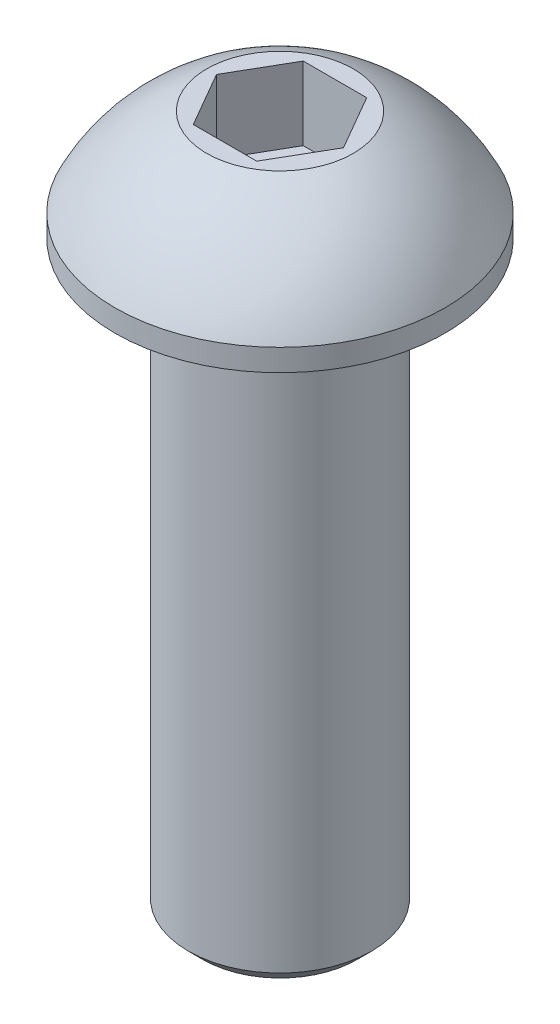
from build123d import *

# Parameters (mm, degrees)
CHAMFER1_SIZE      = 0.2
CUT_EXTRUDE1_START = 0.5
CUT_EXTRUDE1_DEPTH = 10
FILLET1_R          = 0.2


with BuildPart() as part:
    # Sketch1 → Revolve1 (revolve)
    with BuildSketch(Plane.XY, mode=Mode.PRIVATE) as revolve1_sk:
        with BuildLine():
            Line((1.25, 0), (2.25, 0))
            Line((2.25, 0), (2.25, 0.3))
            ThreePointArc((2.25, 0.3), (1.73223122, 1.011699188), (1, 1.5))
            Line((1, 1.5), (0, 1.5))
            Line((0, 1.5), (0, -8))
            Line((0, -8), (1.25, -8))
            Line((1.25, -8), (1.25, 0))
        make_face()
    revolve(revolve1_sk.sketch.rotate(Axis((0, 21.344098617, 0), (0, -1, 0)), 90), axis=Axis((0, 21.344098617, 0), (0, -1, 0)))

    # Chamfer1
    chamfer1_edges = [part.edges().sort_by_distance(p)[0] for p in [
        (0, -8, -1.25),
    ]]
    chamfer(chamfer1_edges, length=CHAMFER1_SIZE)

    # Sketch2 → Cut-Extrude1 (cut)
    with BuildSketch(Plane(origin=(0, 0, 0), x_dir=(1, 0, 0), z_dir=(0, 1, 0)).offset(CUT_EXTRUDE1_START)):
        Polygon((0.433012702, -0.75), (0.866025404, 0), (0.433012702, 0.75), (-0.433012702, 0.75), (-0.866025404, 0), (-0.433012702, -0.75), align=None)
    extrude(amount=CUT_EXTRUDE1_DEPTH, mode=Mode.SUBTRACT)

    # Fillet1
    fillet1_edges = [part.edges().sort_by_distance(p)[0] for p in [
        (0, 0, -1.25),
    ]]
    fillet(fillet1_edges, radius=FILLET1_R)


solid = part.part
